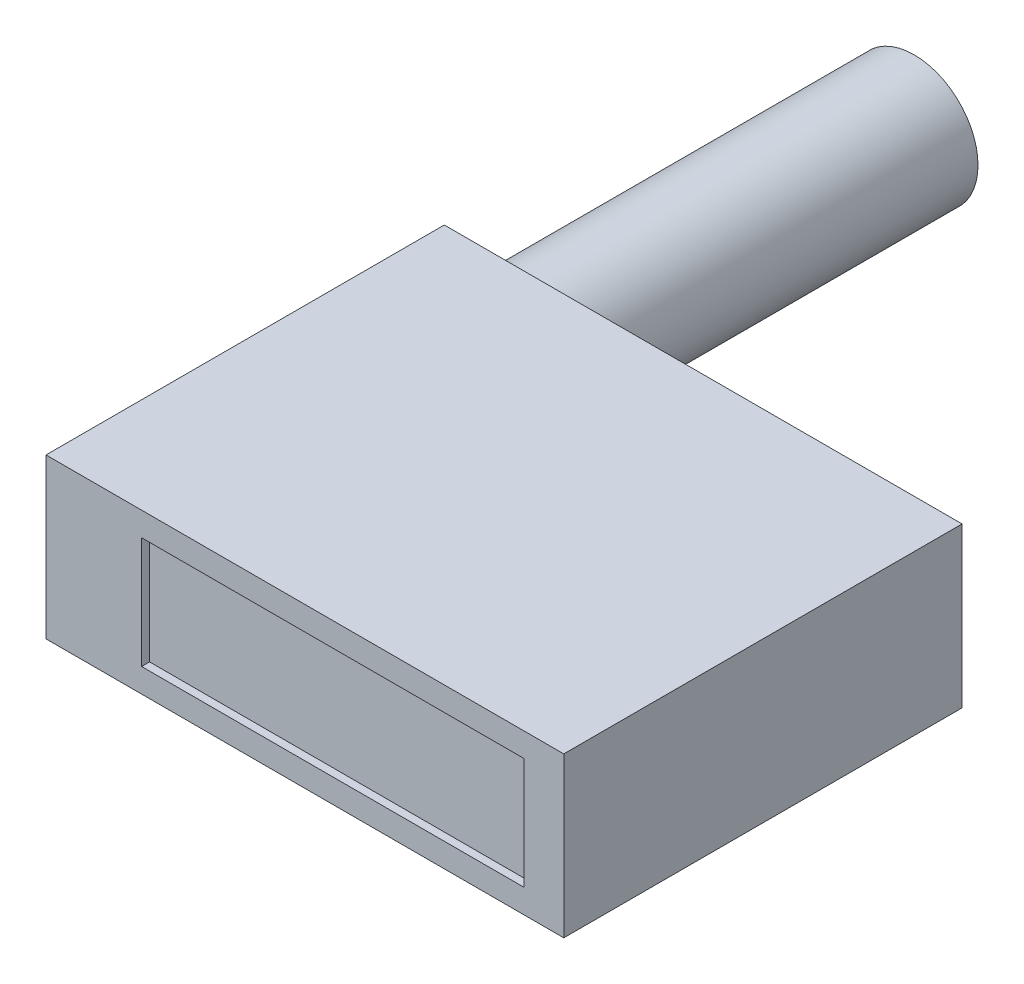
from build123d import *

# Parameters (mm, degrees)
SKETCH2_W           = 65
SKETCH2_H           = 50
BOSS_EXTRUDE1_DEPTH = 20
SKETCH4_W           = 48
SKETCH4_H           = 14
CUT_EXTRUDE1_DEPTH  = 1
SKETCH5_R           = 8
BOSS_EXTRUDE2_DEPTH = 50


with BuildPart() as part:
    # Sketch2 → Boss-Extrude1 (new body)
    with BuildSketch(Plane(origin=(0, 0, 0), x_dir=(1, 0, 0), z_dir=(0, 1, 0))):
        Rectangle(SKETCH2_W, SKETCH2_H)
    extrude(amount=BOSS_EXTRUDE1_DEPTH)

    # Sketch4 → Cut-Extrude1 (cut)
    with BuildSketch(Plane.XY.offset(25)):
        with Locations((3.5, 10)):
            Rectangle(SKETCH4_W, SKETCH4_H)
    extrude(amount=-CUT_EXTRUDE1_DEPTH, mode=Mode.SUBTRACT)

    # Sketch5 → Boss-Extrude2 (add)
    with BuildSketch(Plane(origin=(0, 0, -25), x_dir=(-1, 0, 0), z_dir=(0, 0, -1))):
        with Locations(Location((23.5, 10, 0), (0, 0, 180))):
            Circle(SKETCH5_R)
    extrude(amount=BOSS_EXTRUDE2_DEPTH)


solid = part.part
